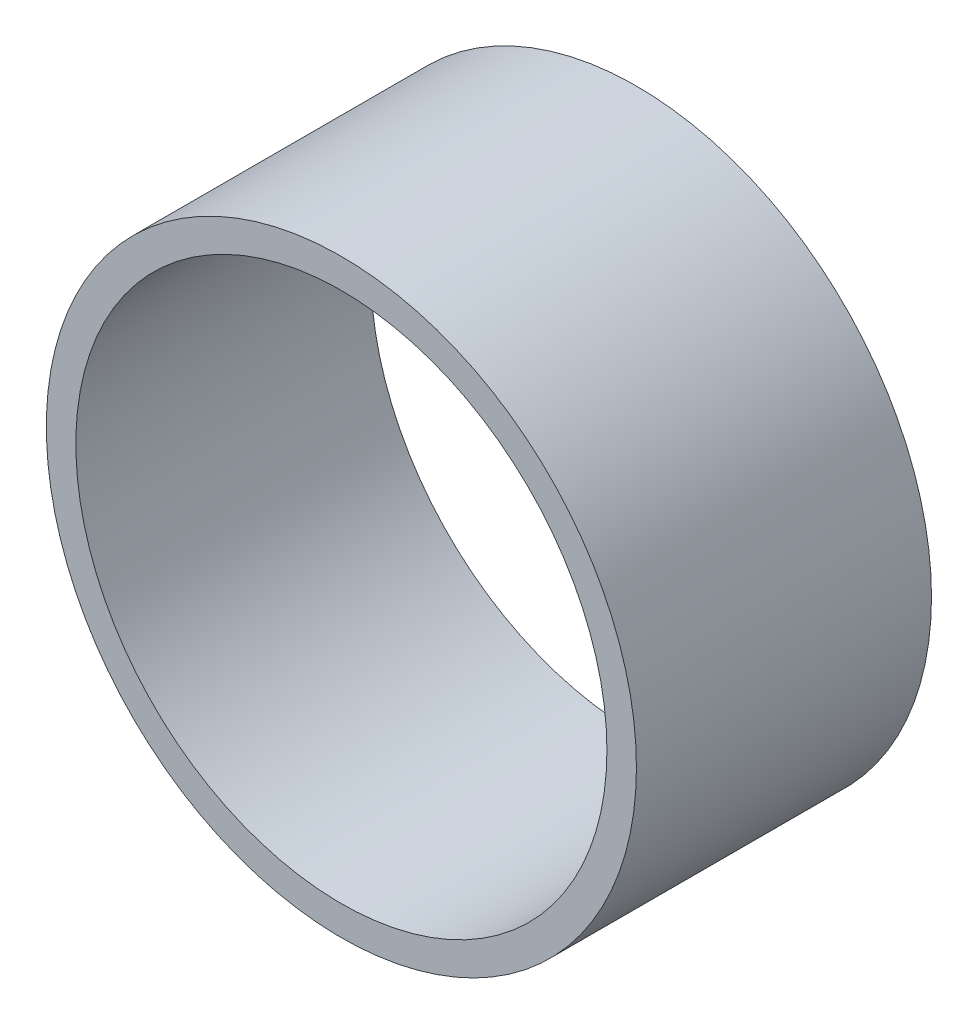
from build123d import *

# Parameters (mm, degrees)
SKETCH1_R           = 50
SKETCH1_R_2         = 45
BOSS_EXTRUDE1_DEPTH = 50


with BuildPart() as part:
    # Sketch1 → Boss-Extrude1 (new body)
    with BuildSketch(Plane.XY):
        Circle(SKETCH1_R)
        Circle(SKETCH1_R_2, mode=Mode.SUBTRACT)
    extrude(amount=BOSS_EXTRUDE1_DEPTH)


solid = part.part
